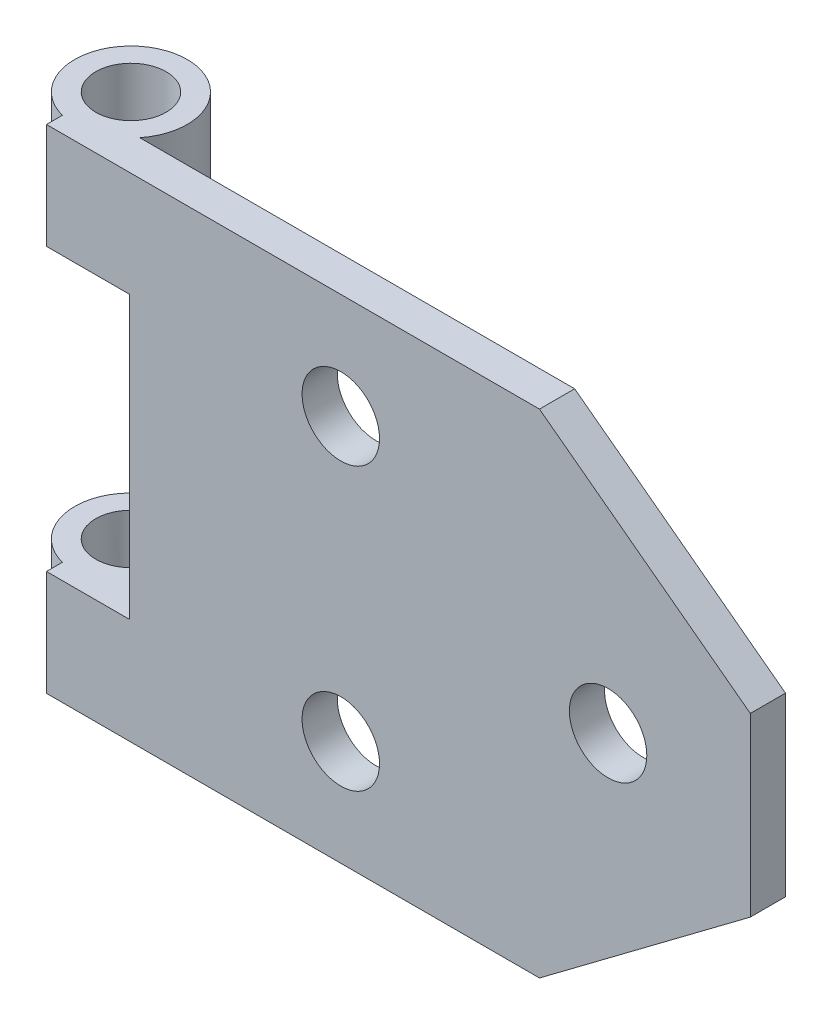
from build123d import *

# Parameters (mm, degrees)
SKETCH1_R               = 5.501178274
BOSS_EXTRUDE1_DEPTH     = 5
SKETCH2_R               = 8
SKETCH2_R_2             = 5
BOSS_EXTRUDE2_DEPTH     = 70
CUT_EXTRUDE1_DEPTH      = 123.755855257
CUT_EXTRUDE1_DEPTH_BACK = 123.755855257
SKETCH3_W               = 17.823798536
SKETCH3_H               = 40


with BuildPart() as part:
    # Sketch1 → Boss-Extrude1 (new body)
    with BuildSketch(Plane.XY):
        Polygon((0, 0), (0, 15), (11.823798536, 15), (11.823798536, 55), (0, 55), (0, 70), (70.043570566, 70), (100, 47.532677925), (100, 22.467322075), (70.043570566, 0), align=None)
        with Locations((41.814977969, 55)):
            Circle(SKETCH1_R, mode=Mode.SUBTRACT)
        with Locations((41.814977969, 15)):
            Circle(SKETCH1_R, mode=Mode.SUBTRACT)
        with Locations((79.789963406, 35)):
            Circle(SKETCH1_R, mode=Mode.SUBTRACT)
    extrude(amount=BOSS_EXTRUDE1_DEPTH)

    # Sketch2 → Boss-Extrude2 (add)
    with BuildSketch(Plane(origin=(0, 0, 0), x_dir=(1, 0, 0), z_dir=(0, 1, 0))):
        with Locations(Location((2, 5, 0), (0, 0, 321.317812547))):
            Circle(SKETCH2_R)
        with Locations(Location((2, 5, 0), (0, 0, 270))):
            Circle(SKETCH2_R_2, mode=Mode.SUBTRACT)
    extrude(amount=BOSS_EXTRUDE2_DEPTH)

    # Sketch3 → Cut-Extrude1 (cut, two sides: drawn at the far end of the back side and taken through both)
    with BuildSketch(Plane.XY.offset(-CUT_EXTRUDE1_DEPTH_BACK)):
        with Locations((2.911899268, 35)):
            Rectangle(SKETCH3_W, SKETCH3_H)
    extrude(amount=CUT_EXTRUDE1_DEPTH + CUT_EXTRUDE1_DEPTH_BACK, mode=Mode.SUBTRACT)


solid = part.part
